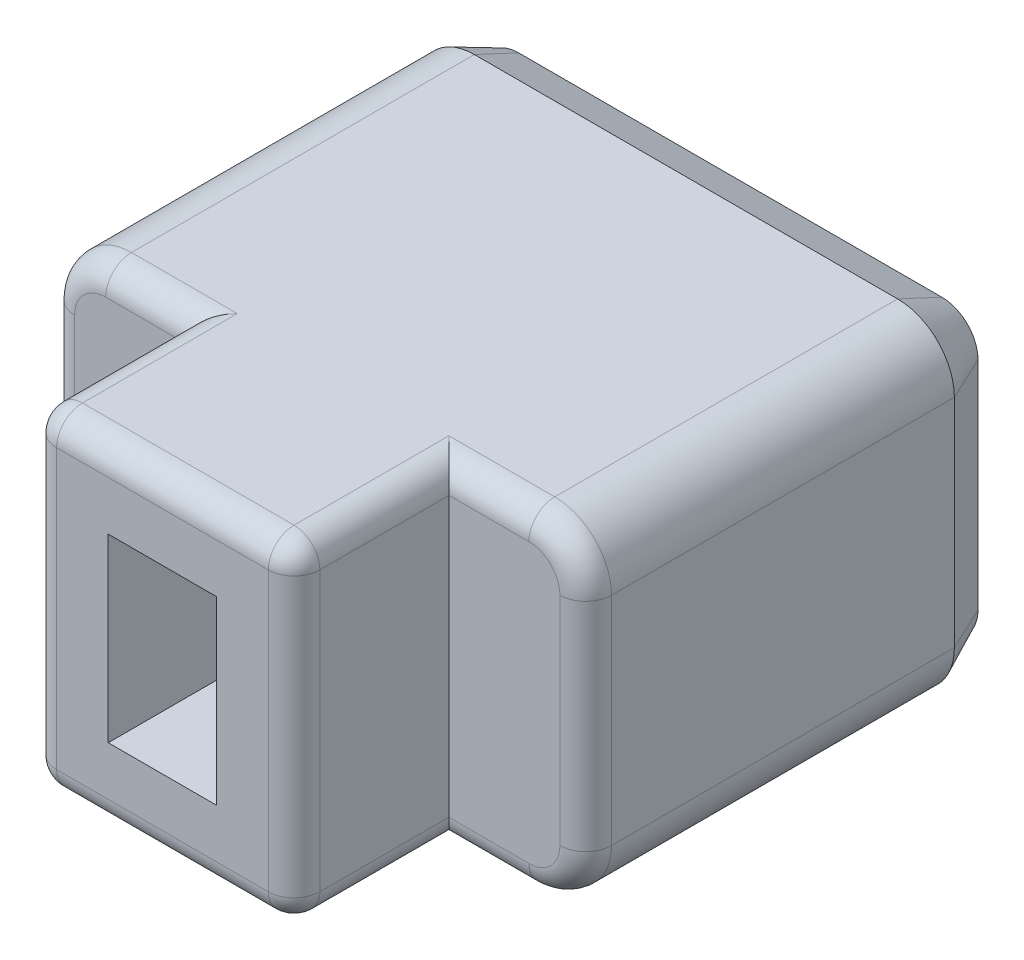
from build123d import *

# Parameters (mm, degrees)
BOSS_EXTRU_1_DEPTH      = 11
ESQUISSE3_W             = 2.1
ESQUISSE3_H             = 3.5
ENL_V_MAT_EXTRU_1_DEPTH = 3
ESQUISSE4_OUTSIDE_W     = 15.688
ESQUISSE4_OUTSIDE_H     = 11.688
ESQUISSE4_OUTSIDE_W_2   = 5.1
ESQUISSE4_OUTSIDE_H_2   = 6.4
ENL_V_MAT_EXTRU_2_DEPTH = 3
CONG_1_R                = 0.5
CHANFREIN1_SIZE         = 0.4
CHANFREIN1_SIZE2        = 0.857802768
ENL_V_MAT_EXTRU_3_DEPTH = 0.3
BOSS_EXTRU_2_DEPTH      = 0.3


with BuildPart() as part:
    # Esquisse2 → Boss.-Extru.1 (new body)
    with BuildSketch(Plane.XY):
        with BuildLine():
            Line((1.1, 0), (9.3, 0))
            ThreePointArc((9.3, 0), (10.077817459, 0.322182541), (10.4, 1.1))
            Line((10.4, 1.1), (10.4, 5.3))
            ThreePointArc((10.4, 5.3), (10.077817459, 6.077817459), (9.3, 6.4))
            Line((9.3, 6.4), (1.1, 6.4))
            ThreePointArc((1.1, 6.4), (0.322182541, 6.077817459), (0, 5.3))
            Line((0, 5.3), (0, 1.1))
            ThreePointArc((0, 1.1), (0.322182541, 0.322182541), (1.1, 0))
        make_face()
    extrude(amount=BOSS_EXTRU_1_DEPTH)

    # Esquisse3 → Enlèv. mat.-Extru.1 (cut)
    with BuildSketch(Plane.XY.offset(11)):
        with Locations((5.2, 3.2)):
            Rectangle(ESQUISSE3_W, ESQUISSE3_H)
    extrude(amount=-ENL_V_MAT_EXTRU_1_DEPTH, mode=Mode.SUBTRACT)

    # Esquisse4 outside → Enlèv. mat.-Extru.2 (cut)
    with BuildSketch(Plane.XY.offset(11)):
        with Locations((5.2, 3.2)):
            Rectangle(ESQUISSE4_OUTSIDE_W, ESQUISSE4_OUTSIDE_H)
        with Locations((5.2, 3.2)):
            Rectangle(ESQUISSE4_OUTSIDE_W_2, ESQUISSE4_OUTSIDE_H_2, mode=Mode.SUBTRACT)
    extrude(amount=-ENL_V_MAT_EXTRU_2_DEPTH, mode=Mode.SUBTRACT)

    # Congé1
    cong_1_edges = [part.edges().sort_by_distance(p)[0] for p in [
        (8.525, 0, 8),
        (10.077817459, 0.322182541, 8),
        (10.4, 3.2, 8),
        (10.077817459, 6.077817459, 8),
        (1.875, 6.4, 8),
        (0.322182541, 6.077817459, 8),
        (1.875, 0, 8),
        (0.322182541, 0.322182541, 8),
        (7.75, 6.4, 9.5),
        (2.65, 6.4, 9.5),
        (7.75, 0, 9.5),
        (2.65, 0, 9.5),
        (2.65, 3.2, 11),
        (5.2, 6.4, 11),
        (7.75, 3.2, 11),
        (5.2, 0, 11),
        (8.525, 6.4, 8),
        (0, 3.2, 8),
    ]]
    fillet(cong_1_edges, radius=CONG_1_R)

    # Chanfrein1
    chanfrein1_edges = [part.edges().sort_by_distance(p)[0] for p in [
        (5.2, 0, 0),
        (10.077817459, 0.322182541, 0),
        (0.322182541, 0.322182541, 0),
        (10.4, 3.2, 0),
        (0, 3.2, 0),
        (10.077817459, 6.077817459, 0),
        (0.322182541, 6.077817459, 0),
        (5.2, 6.4, 0),
    ]]
    chanfrein1_side = [part.faces().sort_by_distance(p)[0] for p in [
        (5.2, 3.2, 0),
    ]]
    chamfer(chanfrein1_edges, length=CHANFREIN1_SIZE, length2=CHANFREIN1_SIZE2, reference=chanfrein1_side[0])

    # Esquisse5 → Enlèv. mat.-Extru.3 (cut)
    with BuildSketch(Plane(origin=(0, 0, 0), x_dir=(-1, 0, 0), z_dir=(0, 0, -1))):
        Polygon((-4.748076923, 1.3), (-5.456410256, 1.3), (-5.456410256, 5.3), (-5.097435897, 5.3), (-5.097435897, 1.71025641), (-4.533333333, 1.71025641), align=None)
    extrude(amount=-ENL_V_MAT_EXTRU_3_DEPTH, mode=Mode.SUBTRACT)


with BuildPart() as body_2:
    # Esquisse5<2> → Boss.-Extru.2 (new body)
    with BuildSketch(Plane(origin=(0, 0, 0), x_dir=(-1, 0, 0), z_dir=(0, 0, -1))):
        Polygon((-4.748076923, 1.3), (-5.456410256, 1.3), (-5.456410256, 5.3), (-5.097435897, 5.3), (-5.097435897, 1.71025641), (-4.533333333, 1.71025641), align=None)
    extrude(amount=BOSS_EXTRU_2_DEPTH)


solid = Compound([part.part, body_2.part])
